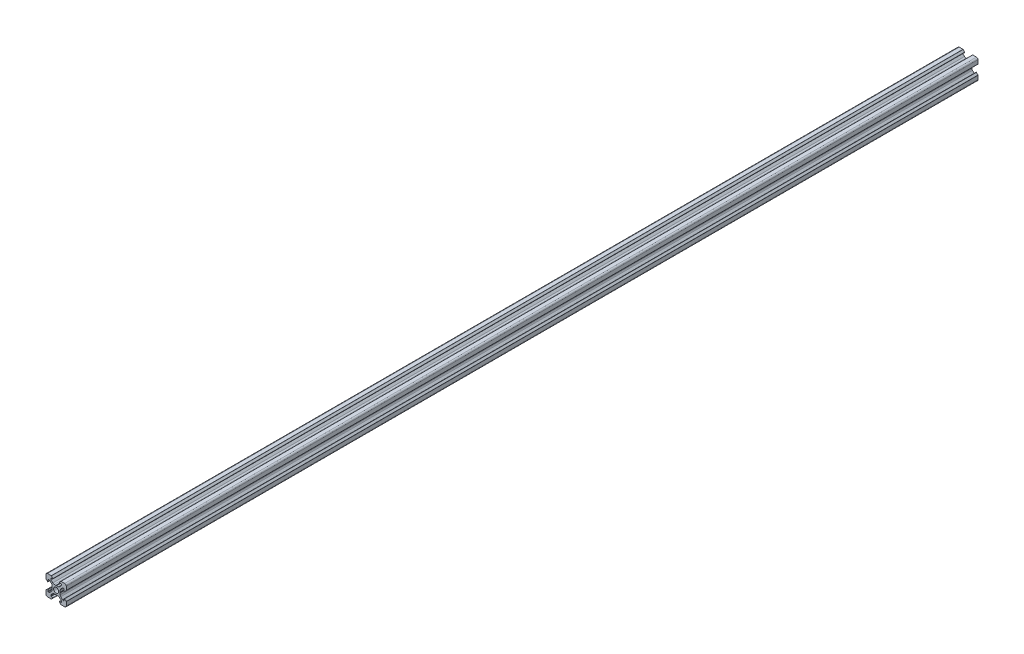
from build123d import *

# Parameters (mm, degrees)
MODEL_R         = 2.5
EXTRUDE_1_DEPTH = 900


with BuildPart() as part:
    # Model → Бобышка-Вытянуть1 (new body)
    with BuildSketch(Plane.XY):
        with BuildLine():
            Line((18.94214915, 33.362214718), (18.94214915, 34.923300122))
            ThreePointArc((18.94214915, 34.923300122), (18.789908215, 35.688666987), (18.356362712, 36.337513684))
            Line((18.356362712, 36.337513684), (16.662250163, 38.031626234))
            ThreePointArc((16.662250163, 38.031626234), (16.337826814, 38.248398985), (15.955143382, 38.324519453))
            Line((15.955143382, 38.324519453), (15.14214915, 38.324519453))
            ThreePointArc((15.14214915, 38.324519453), (15.000727794, 38.265940809), (14.94214915, 38.124519453))
            Line((14.94214915, 38.124519453), (14.94214915, 36.354519453))
            ThreePointArc((14.94214915, 36.354519453), (14.787820008, 36.12354957), (14.515372455, 36.177742757))
            Line((14.515372455, 36.177742757), (13.015372455, 37.677742757))
            ThreePointArc((13.015372455, 37.677742757), (12.961179267, 37.758848595), (12.94214915, 37.854519453))
            Line((12.94214915, 37.854519453), (12.94214915, 41.524519453))
            ThreePointArc((12.94214915, 41.524519453), (13.381488978, 42.585179625), (14.44214915, 43.024519453))
            Line((14.44214915, 43.024519453), (18.11214915, 43.024519453))
            ThreePointArc((18.11214915, 43.024519453), (18.207820008, 43.005489336), (18.288925845, 42.951296148))
            Line((18.288925845, 42.951296148), (19.788925845, 41.451296148))
            ThreePointArc((19.788925845, 41.451296148), (19.843119033, 41.178848595), (19.61214915, 41.024519453))
            Line((19.61214915, 41.024519453), (17.84214915, 41.024519453))
            ThreePointArc((17.84214915, 41.024519453), (17.700727794, 40.965940809), (17.64214915, 40.824519453))
            Line((17.64214915, 40.824519453), (17.64214915, 40.011525221))
            ThreePointArc((17.64214915, 40.011525221), (17.718269617, 39.628841789), (17.935042369, 39.30441844))
            Line((17.935042369, 39.30441844), (19.629154919, 37.61030589))
            ThreePointArc((19.629154919, 37.61030589), (20.278001616, 37.176760388), (21.043368481, 37.024519453))
            Line((21.043368481, 37.024519453), (22.604453885, 37.024519453))
            ThreePointArc((22.604453885, 37.024519453), (22.687205621, 37.010426533), (22.760627647, 36.969736655))
            Line((22.760627647, 36.969736655), (22.94214915, 36.824519453))
            Line((22.94214915, 36.824519453), (23.123670653, 36.969736655))
            ThreePointArc((23.123670653, 36.969736655), (23.197092679, 37.010426533), (23.279844415, 37.024519453))
            Line((23.279844415, 37.024519453), (24.840929819, 37.024519453))
            ThreePointArc((24.840929819, 37.024519453), (25.606296684, 37.176760388), (26.255143382, 37.61030589))
            Line((26.255143382, 37.61030589), (27.949255931, 39.30441844))
            ThreePointArc((27.949255931, 39.30441844), (28.166028683, 39.628841789), (28.24214915, 40.011525221))
            Line((28.24214915, 40.011525221), (28.24214915, 40.824519453))
            ThreePointArc((28.24214915, 40.824519453), (28.183570506, 40.965940809), (28.04214915, 41.024519453))
            Line((28.04214915, 41.024519453), (26.27214915, 41.024519453))
            ThreePointArc((26.27214915, 41.024519453), (26.041179267, 41.178848595), (26.095372455, 41.451296148))
            Line((26.095372455, 41.451296148), (27.595372455, 42.951296148))
            ThreePointArc((27.595372455, 42.951296148), (27.676478292, 43.005489336), (27.77214915, 43.024519453))
            Line((27.77214915, 43.024519453), (31.44214915, 43.024519453))
            ThreePointArc((31.44214915, 43.024519453), (32.502809322, 42.585179625), (32.94214915, 41.524519453))
            Line((32.94214915, 41.524519453), (32.94214915, 37.854519453))
            ThreePointArc((32.94214915, 37.854519453), (32.923119033, 37.758848595), (32.868925845, 37.677742757))
            Line((32.868925845, 37.677742757), (31.368925845, 36.177742757))
            ThreePointArc((31.368925845, 36.177742757), (31.096478292, 36.12354957), (30.94214915, 36.354519453))
            Line((30.94214915, 36.354519453), (30.94214915, 38.124519453))
            ThreePointArc((30.94214915, 38.124519453), (30.883570506, 38.265940809), (30.74214915, 38.324519453))
            Line((30.74214915, 38.324519453), (29.929154919, 38.324519453))
            ThreePointArc((29.929154919, 38.324519453), (29.546471486, 38.248398985), (29.222048137, 38.031626234))
            Line((29.222048137, 38.031626234), (27.527935588, 36.337513684))
            ThreePointArc((27.527935588, 36.337513684), (27.094390085, 35.688666987), (26.94214915, 34.923300122))
            Line((26.94214915, 34.923300122), (26.94214915, 33.362214718))
            ThreePointArc((26.94214915, 33.362214718), (26.92805623, 33.279462982), (26.887366352, 33.206040956))
            Line((26.887366352, 33.206040956), (26.74214915, 33.024519453))
            Line((26.74214915, 33.024519453), (26.887366352, 32.84299795))
            ThreePointArc((26.887366352, 32.84299795), (26.92805623, 32.769575923), (26.94214915, 32.686824188))
            Line((26.94214915, 32.686824188), (26.94214915, 31.125738784))
            ThreePointArc((26.94214915, 31.125738784), (27.094390085, 30.360371919), (27.527935588, 29.711525221))
            Line((27.527935588, 29.711525221), (29.222048137, 28.017412672))
            ThreePointArc((29.222048137, 28.017412672), (29.546471486, 27.80063992), (29.929154919, 27.724519453))
            Line((29.929154919, 27.724519453), (30.74214915, 27.724519453))
            ThreePointArc((30.74214915, 27.724519453), (30.883570506, 27.783098097), (30.94214915, 27.924519453))
            Line((30.94214915, 27.924519453), (30.94214915, 29.694519453))
            ThreePointArc((30.94214915, 29.694519453), (31.096478292, 29.925489336), (31.368925845, 29.871296148))
            Line((31.368925845, 29.871296148), (32.868925845, 28.371296148))
            ThreePointArc((32.868925845, 28.371296148), (32.923119033, 28.290190311), (32.94214915, 28.194519453))
            Line((32.94214915, 28.194519453), (32.94214915, 24.524519453))
            ThreePointArc((32.94214915, 24.524519453), (32.502809322, 23.463859281), (31.44214915, 23.024519453))
            Line((31.44214915, 23.024519453), (27.77214915, 23.024519453))
            ThreePointArc((27.77214915, 23.024519453), (27.676478292, 23.04354957), (27.595372455, 23.097742757))
            Line((27.595372455, 23.097742757), (26.095372455, 24.597742757))
            ThreePointArc((26.095372455, 24.597742757), (26.041179267, 24.870190311), (26.27214915, 25.024519453))
            Line((26.27214915, 25.024519453), (28.04214915, 25.024519453))
            ThreePointArc((28.04214915, 25.024519453), (28.183570506, 25.083098097), (28.24214915, 25.224519453))
            Line((28.24214915, 25.224519453), (28.24214915, 26.037513684))
            ThreePointArc((28.24214915, 26.037513684), (28.166028683, 26.420197117), (27.949255931, 26.744620465))
            Line((27.949255931, 26.744620465), (26.255143382, 28.438733015))
            ThreePointArc((26.255143382, 28.438733015), (25.606296684, 28.872278518), (24.840929819, 29.024519453))
            Line((24.840929819, 29.024519453), (23.279844415, 29.024519453))
            ThreePointArc((23.279844415, 29.024519453), (23.197092679, 29.038612373), (23.123670653, 29.07930225))
            Line((23.123670653, 29.07930225), (22.94214915, 29.224519453))
            Line((22.94214915, 29.224519453), (22.760627647, 29.07930225))
            ThreePointArc((22.760627647, 29.07930225), (22.687205621, 29.038612373), (22.604453885, 29.024519453))
            Line((22.604453885, 29.024519453), (21.043368481, 29.024519453))
            ThreePointArc((21.043368481, 29.024519453), (20.278001616, 28.872278518), (19.629154919, 28.438733015))
            Line((19.629154919, 28.438733015), (17.935042369, 26.744620465))
            ThreePointArc((17.935042369, 26.744620465), (17.718269617, 26.420197117), (17.64214915, 26.037513684))
            Line((17.64214915, 26.037513684), (17.64214915, 25.224519453))
            ThreePointArc((17.64214915, 25.224519453), (17.700727794, 25.083098097), (17.84214915, 25.024519453))
            Line((17.84214915, 25.024519453), (19.61214915, 25.024519453))
            ThreePointArc((19.61214915, 25.024519453), (19.843119033, 24.870190311), (19.788925845, 24.597742757))
            Line((19.788925845, 24.597742757), (18.288925845, 23.097742757))
            ThreePointArc((18.288925845, 23.097742757), (18.207820008, 23.04354957), (18.11214915, 23.024519453))
            Line((18.11214915, 23.024519453), (14.44214915, 23.024519453))
            ThreePointArc((14.44214915, 23.024519453), (13.381488978, 23.463859281), (12.94214915, 24.524519453))
            Line((12.94214915, 24.524519453), (12.94214915, 28.194519453))
            ThreePointArc((12.94214915, 28.194519453), (12.961179267, 28.290190311), (13.015372455, 28.371296148))
            Line((13.015372455, 28.371296148), (14.515372455, 29.871296148))
            ThreePointArc((14.515372455, 29.871296148), (14.787820008, 29.925489336), (14.94214915, 29.694519453))
            Line((14.94214915, 29.694519453), (14.94214915, 27.924519453))
            ThreePointArc((14.94214915, 27.924519453), (15.000727794, 27.783098097), (15.14214915, 27.724519453))
            Line((15.14214915, 27.724519453), (15.955143382, 27.724519453))
            ThreePointArc((15.955143382, 27.724519453), (16.337826814, 27.80063992), (16.662250163, 28.017412672))
            Line((16.662250163, 28.017412672), (18.356362712, 29.711525221))
            ThreePointArc((18.356362712, 29.711525221), (18.789908215, 30.360371919), (18.94214915, 31.125738784))
            Line((18.94214915, 31.125738784), (18.94214915, 32.686824188))
            ThreePointArc((18.94214915, 32.686824188), (18.95624207, 32.769575923), (18.996931948, 32.84299795))
            Line((18.996931948, 32.84299795), (19.14214915, 33.024519453))
            Line((19.14214915, 33.024519453), (18.996931948, 33.206040956))
            ThreePointArc((18.996931948, 33.206040956), (18.95624207, 33.279462982), (18.94214915, 33.362214718))
        make_face()
        with Locations((22.94214915, 33.024519453)):
            Circle(MODEL_R, mode=Mode.SUBTRACT)
    extrude(amount=EXTRUDE_1_DEPTH)


solid = part.part
